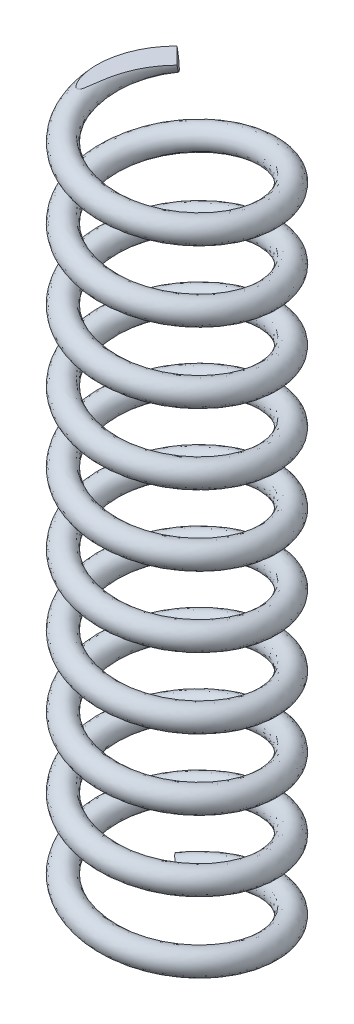
from build123d import *

# Parameters (mm, degrees)
SWEEP1_PITCH       = 2.4
SWEEP1_HEIGHT      = 24
SWEEP1_RADIUS      = 2.75
SWEEP1_START_ANGLE = -135
SWEEP1_PROFILE_R   = 0.4
CUT_EXTRUDE1_REACH = 26.8
SKETCH21_W         = 6.100235039
SKETCH21_H         = 3.895484728
CUT_EXTRUDE2_REACH = 26.8
SKETCH22_W         = 7.210212381
SKETCH22_H         = 6.505584927


with BuildPart() as part:
    # Sweep1: sweep along a helix
    with BuildLine() as sweep1_path:
        add(Helix(SWEEP1_PITCH, SWEEP1_HEIGHT, SWEEP1_RADIUS, center=(0, 0, 0), direction=(0, 1, 0), lefthand=True, mode=Mode.PRIVATE).rotate(Axis((0, 0, 0), (0, 1, 0)), SWEEP1_START_ANGLE))
    # Sweep1 profile (on start of the path) → Sweep1 (sweep)
    with BuildSketch(Plane(origin=(-1.944543648, 0, -1.944543648), x_dir=(0.7071067811863336, 0, 0.7071067811867615), z_dir=(0.70038285151084, 0.13757806009565213, -0.7003828515104162))):
        Circle(SWEEP1_PROFILE_R)
    sweep(path=sweep1_path.line, is_frenet=True)

    # Sketch21 → Cut-Extrude1 (cut, up to next)
    with BuildSketch(Plane(origin=(0, 0, 0), x_dir=(1, 0, 0), z_dir=(0, 1, 0)), mode=Mode.PRIVATE) as cut_extrude1_sk1:
        with Locations((-0.135326621, 1.477346377)):
            Rectangle(SKETCH21_W, SKETCH21_H)
    cut_extrude1_tool1 = extrude(cut_extrude1_sk1.sketch, amount=-CUT_EXTRUDE1_REACH, mode=Mode.PRIVATE) & part.part
    add(cut_extrude1_tool1.solids().sort_by_distance((-0.135327, 0, -1.477346))[0], mode=Mode.SUBTRACT)

    # Sketch22 → Cut-Extrude2 (cut, up to next)
    with BuildSketch(Plane(origin=(0, 24, 0), x_dir=(1, 0, 0), z_dir=(0, 1, 0)), mode=Mode.PRIVATE) as cut_extrude2_sk1:
        with Locations((-0.234742916, 0.253982107)):
            Rectangle(SKETCH22_W, SKETCH22_H)
    cut_extrude2_tool1 = extrude(cut_extrude2_sk1.sketch, amount=CUT_EXTRUDE2_REACH, mode=Mode.PRIVATE) & part.part
    add(cut_extrude2_tool1.solids().sort_by_distance((-0.234743, 24, -0.253982))[0], mode=Mode.SUBTRACT)


solid = part.part
